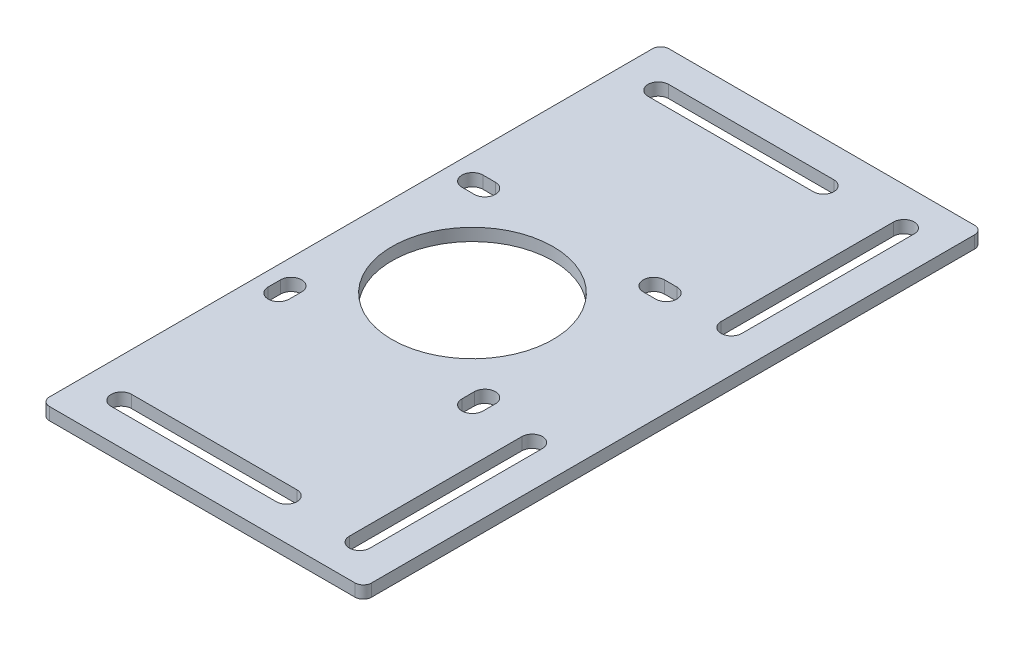
from build123d import *

# Parameters (mm, degrees)
SKETCH1_R           = 19.5
BOSS_EXTRUDE1_DEPTH = 3


with BuildPart() as part:
    # Sketch1 → Boss-Extrude1 (new body)
    with BuildSketch(Plane(origin=(0, 0, 0), x_dir=(1, 0, 0), z_dir=(0, 1, 0))):
        with BuildLine():
            Line((-37, 75), (37, 75))
            ThreePointArc((37, 75), (38.414213562, 74.414213562), (39, 73))
            Line((39, 73), (39, -73))
            ThreePointArc((39, -73), (38.414213562, -74.414213562), (37, -75))
            Line((37, -75), (-37, -75))
            ThreePointArc((-37, -75), (-38.414213562, -74.414213562), (-39, -73))
            Line((-39, -73), (-39, 73))
            ThreePointArc((-39, 73), (-38.414213562, 74.414213562), (-37, 75))
        make_face()
        with Locations(Location((-9.57, 0, 0), (0, 0, 270))):
            Circle(SKETCH1_R, mode=Mode.SUBTRACT)
        with BuildLine():
            Line((31.5, 65.876713653), (31.5, 24.123286347))
            ThreePointArc((31.5, 24.123286347), (29, 21.623286347), (26.5, 24.123286347))
            Line((26.5, 24.123286347), (26.5, 65.876713653))
            ThreePointArc((26.5, 65.876713653), (29, 68.376713653), (31.5, 65.876713653))
        make_face(mode=Mode.SUBTRACT)
        with BuildLine():
            Line((31.5, -65.876713653), (31.5, -24.123286347))
            ThreePointArc((31.5, -24.123286347), (29, -21.623286347), (26.5, -24.123286347))
            Line((26.5, -24.123286347), (26.5, -65.876713653))
            ThreePointArc((26.5, -65.876713653), (29, -68.376713653), (31.5, -65.876713653))
        make_face(mode=Mode.SUBTRACT)
        with BuildLine():
            Line((-29.57, 67.5), (10.43, 67.5))
            ThreePointArc((10.43, 67.5), (12.93, 65), (10.43, 62.5))
            Line((10.43, 62.5), (-29.57, 62.5))
            ThreePointArc((-29.57, 62.5), (-32.07, 65), (-29.57, 67.5))
        make_face(mode=Mode.SUBTRACT)
        with BuildLine():
            Line((-29.57, -67.5), (10.43, -67.5))
            ThreePointArc((10.43, -67.5), (12.93, -65), (10.43, -62.5))
            Line((10.43, -62.5), (-29.57, -62.5))
            ThreePointArc((-29.57, -62.5), (-32.07, -65), (-29.57, -67.5))
        make_face(mode=Mode.SUBTRACT)
        with BuildLine():
            Line((-33.028267466, 26.008267466), (-30.028267466, 26.008267466))
            ThreePointArc((-30.028267466, 26.008267466), (-27.478267466, 23.458267466), (-30.028267466, 20.908267466))
            Line((-30.028267466, 20.908267466), (-33.028267466, 20.908267466))
            ThreePointArc((-33.028267466, 20.908267466), (-35.578267466, 23.458267466), (-33.028267466, 26.008267466))
        make_face(mode=Mode.SUBTRACT)
        with BuildLine():
            Line((13.888267466, 26.008267466), (10.888267466, 26.008267466))
            ThreePointArc((10.888267466, 26.008267466), (8.338267466, 23.458267466), (10.888267466, 20.908267466))
            Line((10.888267466, 20.908267466), (13.888267466, 20.908267466))
            ThreePointArc((13.888267466, 20.908267466), (16.438267466, 23.458267466), (13.888267466, 26.008267466))
        make_face(mode=Mode.SUBTRACT)
        with BuildLine():
            Line((-35.578267466, -23.458267466), (-35.578267466, -20.458267466))
            ThreePointArc((-35.578267466, -20.458267466), (-33.028267466, -17.908267466), (-30.478267466, -20.458267466))
            Line((-30.478267466, -20.458267466), (-30.478267466, -23.458267466))
            ThreePointArc((-30.478267466, -23.458267466), (-33.028267466, -26.008267466), (-35.578267466, -23.458267466))
        make_face(mode=Mode.SUBTRACT)
        with BuildLine():
            Line((16.438267466, -23.458267466), (16.438267466, -20.458267466))
            ThreePointArc((16.438267466, -20.458267466), (13.888267466, -17.908267466), (11.338267466, -20.458267466))
            Line((11.338267466, -20.458267466), (11.338267466, -23.458267466))
            ThreePointArc((11.338267466, -23.458267466), (13.888267466, -26.008267466), (16.438267466, -23.458267466))
        make_face(mode=Mode.SUBTRACT)
    extrude(amount=BOSS_EXTRUDE1_DEPTH)


solid = part.part
